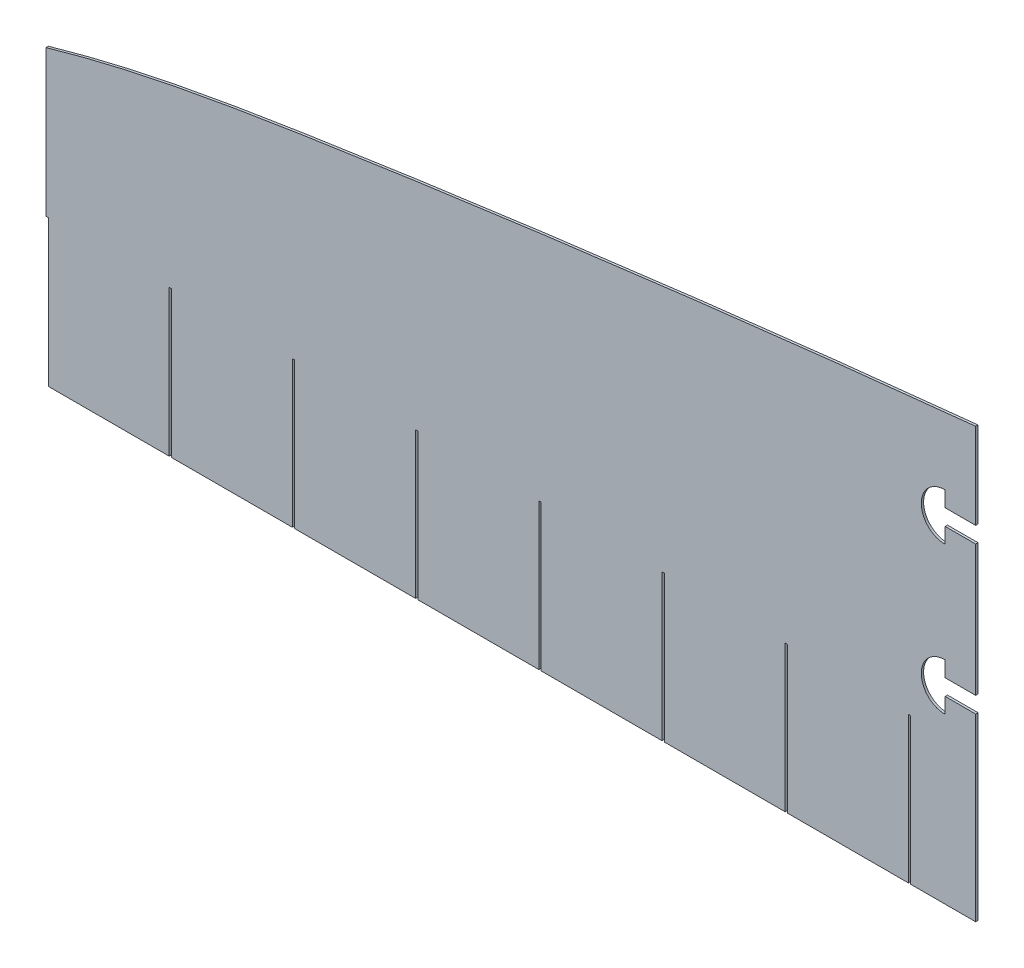
from build123d import *

# Parameters (mm, degrees)
BOSS_EXTRUDE1_DEPTH = 3


with BuildPart() as part:
    # Model → Boss-Extrude1 (new body)
    with BuildSketch(Plane.XY):
        with BuildLine():
            Line((1255.301037795, 443.027781841), (1294.701037813, 443.027781841))
            Line((1294.701037813, 443.027781841), (1294.701037813, 553.849315832))
            add(Edge.make_bspline(
                [(1294.701037813, 553.849315832), (987.96597569, 523.139532485), (557.602899872, 467.780280961), (240.864040268, 415.199018528), (137.973344871, 389.690933185), (94.901037796, 377.220662508)],
                knots=[0.108777165, 0.108777165, 0.108777165, 0.108777165, 0.189662497, 0.216203451, 0.238160454, 0.238160454, 0.238160454, 0.238160454], degree=3))
            Line((94.901037796, 377.220662508), (94.901037796, 188.610331254))
            Line((94.901037796, 188.610331254), (97.901037796, 188.610331254))
            Line((97.901037796, 188.610331254), (97.901037796, 0))
            Line((97.901037796, 0), (253.901037796, 0))
            Line((253.901037796, 0), (253.901037796, 188.610331254))
            Line((253.901037796, 188.610331254), (256.901037795, 188.610331254))
            Line((256.901037795, 188.610331254), (256.901037795, 0))
            Line((256.901037795, 0), (412.901037795, 0))
            Line((412.901037795, 0), (412.901037795, 188.610331254))
            Line((412.901037795, 188.610331254), (415.901037795, 188.610331254))
            Line((415.901037795, 188.610331254), (415.901037795, 0))
            Line((415.901037795, 0), (571.901037795, 0))
            Line((571.901037795, 0), (571.901037795, 188.610331254))
            Line((571.901037795, 188.610331254), (574.901037795, 188.610331254))
            Line((574.901037795, 188.610331254), (574.901037795, 0))
            Line((574.901037795, 0), (730.901037795, 0))
            Line((730.901037795, 0), (730.901037795, 188.610331254))
            Line((730.901037795, 188.610331254), (733.901037795, 188.610331254))
            Line((733.901037795, 188.610331254), (733.901037795, 0))
            Line((733.901037795, 0), (889.901037795, 0))
            Line((889.901037795, 0), (889.901037795, 188.610331254))
            Line((889.901037795, 188.610331254), (892.901037795, 188.610331254))
            Line((892.901037795, 188.610331254), (892.901037795, 0))
            Line((892.901037795, 0), (1048.901037796, 0))
            Line((1048.901037796, 0), (1048.901037796, 188.610331254))
            Line((1048.901037796, 188.610331254), (1051.901037795, 188.610331254))
            Line((1051.901037795, 188.610331254), (1051.901037795, 0))
            Line((1051.901037795, 0), (1207.901037796, 0))
            Line((1207.901037796, 0), (1207.901037796, 188.610331254))
            Line((1207.901037796, 188.610331254), (1210.901037796, 188.610331254))
            Line((1210.901037796, 188.610331254), (1210.901037796, 0))
            Line((1210.901037796, 0), (1294.701037796, 0))
            Line((1294.701037796, 0), (1294.701037796, 232.227781841))
            Line((1294.701037796, 232.227781841), (1255.301037795, 232.227781841))
            Line((1255.301037795, 232.227781841), (1255.301037795, 212.230413534))
            ThreePointArc((1255.301037795, 212.230413534), (1224.501037792, 242.627781841), (1255.301037795, 273.025150148))
            Line((1255.301037795, 273.025150148), (1255.301037795, 253.027781841))
            Line((1255.301037795, 253.027781841), (1294.701037796, 253.027781841))
            Line((1294.701037796, 253.027781841), (1294.701037796, 422.227781841))
            Line((1294.701037796, 422.227781841), (1255.301037795, 422.227781841))
            Line((1255.301037795, 422.227781841), (1255.301037795, 402.230413534))
            ThreePointArc((1255.301037795, 402.230413534), (1224.501037792, 432.627781841), (1255.301037795, 463.025150148))
            Line((1255.301037795, 463.025150148), (1255.301037795, 443.027781841))
        make_face()
    extrude(amount=BOSS_EXTRUDE1_DEPTH)


solid = part.part
